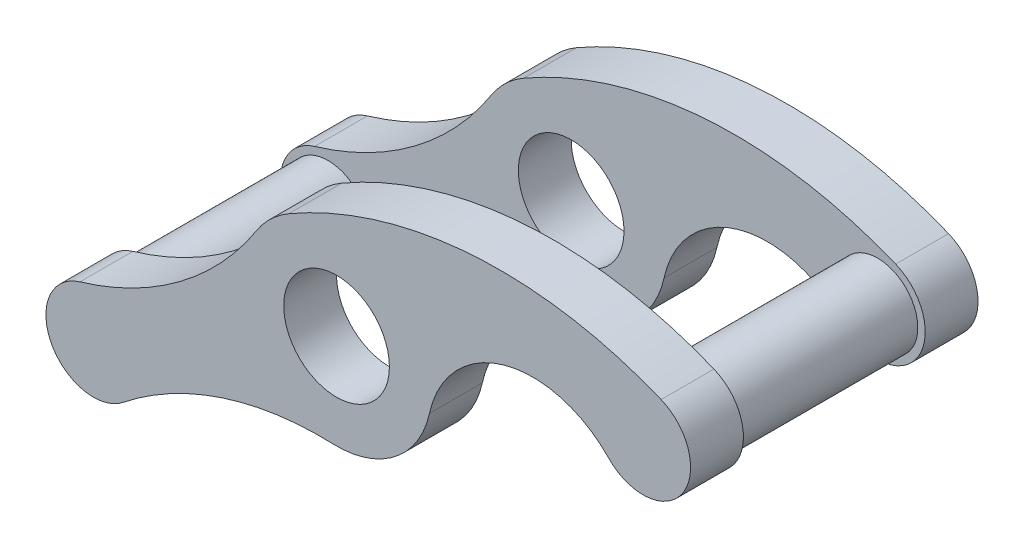
from build123d import *

# Parameters (mm, degrees)
CROQUIS1_R              = 2.5
SALIENTE_EXTRUIR1_DEPTH = 2.5
CROQUIS2_R              = 1.9
SALIENTE_EXTRUIR2_DEPTH = 8.6
CROQUIS3_R              = 2.5
SALIENTE_EXTRUIR3_DEPTH = 2.5


with BuildPart() as part:
    # Croquis1 → Saliente-Extruir1 (new body)
    with BuildSketch(Plane.XY):
        with BuildLine():
            ThreePointArc((-0.171650138, -4.496725056), (2.753921849, -3.558920405), (4.395901196, -0.962316307))
            ThreePointArc((4.395901196, -0.962316307), (7.9188241, 2.779530342), (12.880073197, 1.43848242))
            ThreePointArc((12.880073197, 1.43848242), (16.361169276, 1.735662654), (15.354744139, 5.081324688))
            ThreePointArc((15.354744139, 5.081324688), (6.413547413, 6.535486918), (-2.252037616, 3.895937188))
            ThreePointArc((-2.252037616, 3.895937188), (-3.106745208, 3.25547757), (-3.786445073, 2.431631903))
            ThreePointArc((-3.786445073, 2.431631903), (-7.399355323, -1.45649364), (-12.140164606, -3.842990664))
            ThreePointArc((-12.140164606, -3.842990664), (-13.494815904, -7.040773515), (-10.097019643, -7.75901851))
            ThreePointArc((-10.097019643, -7.75901851), (-5.427542776, -5.235801021), (-0.171650138, -4.496725056))
        make_face()
        Circle(CROQUIS1_R, mode=Mode.SUBTRACT)
    extrude(amount=SALIENTE_EXTRUIR1_DEPTH)

    # Croquis2 → Saliente-Extruir2 (add)
    with BuildSketch(Plane.XY.offset(2.5)):
        with Locations(Location((-11.5, -6, 0), (0, 0, 180))):
            Circle(CROQUIS2_R)
        with Locations(Location((14.5, 3, 0), (0, 0, 180))):
            Circle(CROQUIS2_R)
    extrude(amount=SALIENTE_EXTRUIR2_DEPTH)

    # Croquis3 → Saliente-Extruir3 (add)
    with BuildSketch(Plane.XY.offset(11.1)):
        with BuildLine():
            ThreePointArc((12.880073197, 1.43848242), (16.361169276, 1.735662654), (15.354744139, 5.081324688))
            ThreePointArc((15.354744139, 5.081324688), (6.413547413, 6.535486918), (-2.252037616, 3.895937188))
            ThreePointArc((-2.252037616, 3.895937188), (-3.106745208, 3.25547757), (-3.786445073, 2.431631903))
            ThreePointArc((-3.786445073, 2.431631903), (-7.399355323, -1.45649364), (-12.140164606, -3.842990664))
            ThreePointArc((-12.140164606, -3.842990664), (-13.494815904, -7.040773515), (-10.097019643, -7.75901851))
            ThreePointArc((-10.097019643, -7.75901851), (-5.427542776, -5.235801021), (-0.171650138, -4.496725056))
            ThreePointArc((-0.171650138, -4.496725056), (2.753921849, -3.558920405), (4.395901196, -0.962316307))
            ThreePointArc((4.395901196, -0.962316307), (7.9188241, 2.779530342), (12.880073197, 1.43848242))
        make_face()
        Circle(CROQUIS3_R, mode=Mode.SUBTRACT)
    extrude(amount=SALIENTE_EXTRUIR3_DEPTH)


solid = part.part
